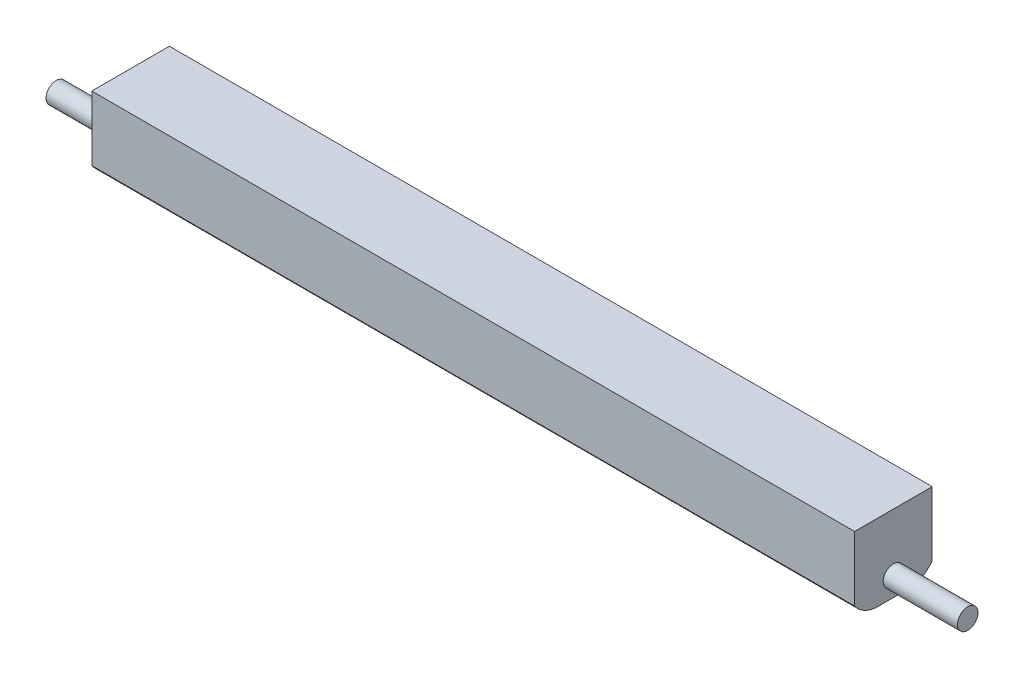
from build123d import *

# Parameters (mm, degrees)
BOSS_EXTRUDE1_DEPTH = 930.000000042
SKETCH2_R           = 25
BOSS_EXTRUDE2_DEPTH = 1111.25


with BuildPart() as part:
    # Sketch11 → Boss-Extrude1 (new, symmetric)
    with BuildSketch(Plane(origin=(0, 0, 0), x_dir=(0, 0, -1), z_dir=(1, 0, 0))):
        with BuildLine():
            Line((-94.634542526, 140.618265246), (-94.634542526, -16.759321043))
            add(Edge.make_bspline(
                [(-94.634542526, -16.759321043), (-84.796398937, -31.685202318), (-69.208991885, -41.543873053), (-51.629015176, -46.966208653), (-38.383860366, -46.381734754)],
                knots=[0, 0, 0, 0, 0, 1, 1, 1, 1, 1], degree=4))
            Line((-38.383860366, -46.381734754), (35.700403673, -46.381734754))
            add(Edge.make_bspline(
                [(94.634542526, -16.759321059), (68.088856738, -47.700845058), (35.700403673, -46.381734754)],
                knots=[0, 0, 0, 0.879181674, 0.879181674, 0.879181674], degree=2))
            Line((94.634542526, -16.759321059), (94.634542526, 140.618265246))
            Line((94.634542526, 140.618265246), (-94.634542526, 140.618265246))
        make_face()
    extrude(amount=BOSS_EXTRUDE1_DEPTH, both=True)


with BuildPart() as body_2:
    # Sketch2 → Boss-Extrude2 (new, symmetric)
    with BuildSketch(Plane(origin=(0, 0, 0), x_dir=(0, 0, -1), z_dir=(1, 0, 0))):
        Circle(SKETCH2_R)
    extrude(amount=BOSS_EXTRUDE2_DEPTH, both=True)


solid = Compound([part.part, body_2.part])
